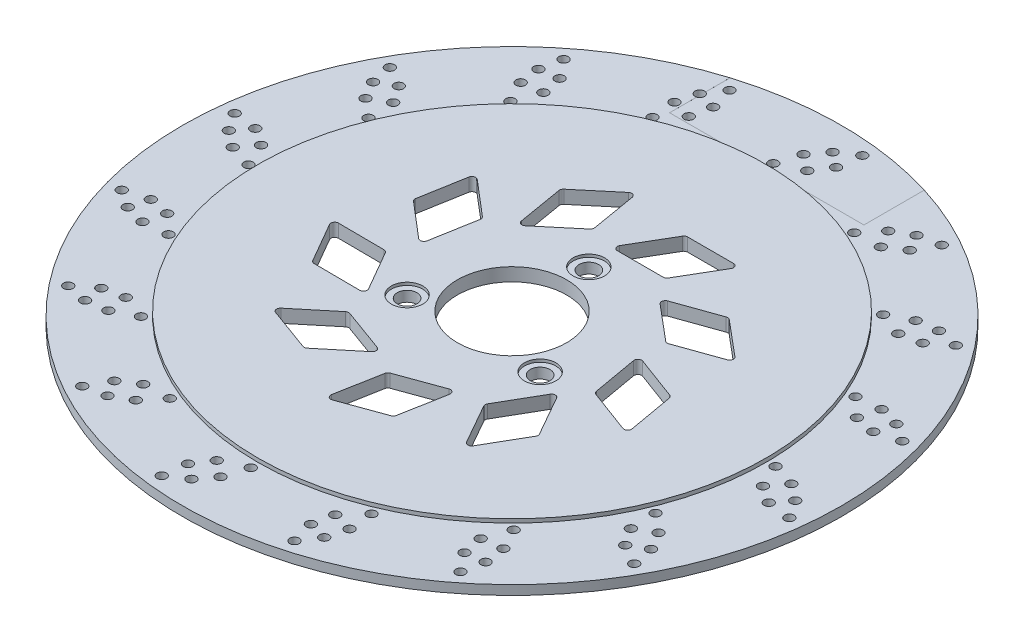
from build123d import *

# Parameters (mm, degrees)
SKETCH1_R           = 135
SKETCH1_R_2         = 29
BOSS_EXTRUDE1_DEPTH = 7
SKETCH1_3_R         = 175
SKETCH1_3_R_2       = 135
BOSS_EXTRUDE2_DEPTH = 5
SKETCH7_R           = 5.2
CUT_EXTRUDE9_DEPTH  = 248.586348574
SKETCH11_R          = 8.35
CUT_EXTRUDE10_DEPTH = 1.5
CIRPATTERN1_COUNT   = 3
CIRPATTERN2_COUNT   = 3
CUT_EXTRUDE11_DEPTH = 248.586348574
SKETCH14_R          = 2.5
CUT_EXTRUDE12_DEPTH = 248.53787589
CIRPATTERN3_COUNT   = 16
SKETCH15_R          = 175
SKETCH15_R_2        = 135
CUT_EXTRUDE13_DEPTH = 0.01
SKETCH16_W          = 103.216038505
SKETCH16_H          = 40.53333701
CUT_EXTRUDE14_DEPTH = 0.01
SKETCH17_W          = 102.14000893
SKETCH17_H          = 42.38101065
CUT_EXTRUDE15_DEPTH = 0.01


with BuildPart() as part:
    # Sketch1 → Boss-Extrude1 (new body)
    with BuildSketch(Plane(origin=(0, 0, 0), x_dir=(1, 0, 0), z_dir=(0, 1, 0))):
        with Locations(Location((0, 0, 0), (0, 0, 270))):
            Circle(SKETCH1_R)
        with Locations(Location((0, 0, 0), (0, 0, 270))):
            Circle(SKETCH1_R_2, mode=Mode.SUBTRACT)
    extrude(amount=BOSS_EXTRUDE1_DEPTH)

    # Sketch1<3> → Boss-Extrude2 (add)
    with BuildSketch(Plane(origin=(0, 0, 0), x_dir=(1, 0, 0), z_dir=(0, 1, 0))):
        with Locations(Location((0, 0, 0), (0, 0, 270))):
            Circle(SKETCH1_3_R)
        with Locations(Location((0, 0, 0), (0, 0, 270))):
            Circle(SKETCH1_3_R_2, mode=Mode.SUBTRACT)
    extrude(amount=BOSS_EXTRUDE2_DEPTH)

    # Sketch7 → Cut-Extrude9 (cut, through all)
    with BuildSketch(Plane(origin=(0, 7, 0), x_dir=(1, 0, 0), z_dir=(0, 1, 0))):
        with Locations(Location((0, 40.8, 0), (0, 0, 270))):
            Circle(SKETCH7_R)
    cut_extrude9 = extrude(amount=-CUT_EXTRUDE9_DEPTH, mode=Mode.SUBTRACT)

    # Sketch11 → Cut-Extrude10 (cut)
    with BuildSketch(Plane(origin=(0, 7, 0), x_dir=(1, 0, 0), z_dir=(0, 1, 0))):
        with Locations(Location((0, 40.8, 0), (0, 0, 270))):
            Circle(SKETCH11_R)
    cut_extrude10 = extrude(amount=-CUT_EXTRUDE10_DEPTH, mode=Mode.SUBTRACT)

    # CirPattern1: Cut-Extrude9 ×3 about axis
    cirpattern1_axis = Axis((0, 0, 0), (0, 1, 0))
    for i in range(1, CIRPATTERN1_COUNT):
        add(cut_extrude9.rotate(cirpattern1_axis, i * 360 / CIRPATTERN1_COUNT), mode=Mode.SUBTRACT)

    # CirPattern2: Cut-Extrude10 ×3 about axis
    cirpattern2_axis = Axis((0, 0, 0), (0, 1, 0))
    for i in range(1, CIRPATTERN2_COUNT):
        add(cut_extrude10.rotate(cirpattern2_axis, i * 360 / CIRPATTERN2_COUNT), mode=Mode.SUBTRACT)

    # Sketch13 → Cut-Extrude11 (cut, through all)
    with BuildSketch(Plane(origin=(0, 7, 0), x_dir=(1, 0, 0), z_dir=(0, 1, 0))):
        with BuildLine():
            Line((0.125749805, 55.8), (24.472230204, 55.8))
            ThreePointArc((24.472230204, 55.8), (25.466236439, 56.064502491), (26.197325549, 56.788048395))
            Line((26.197325549, 56.788048395), (38.516055508, 77.788048395))
            ThreePointArc((38.516055508, 77.788048395), (38.526457673, 79.794006235), (36.790960164, 80.8))
            Line((36.790960164, 80.8), (12.444479765, 80.8))
            ThreePointArc((12.444479765, 80.8), (11.45047353, 80.535497509), (10.71938442, 79.811951605))
            Line((10.71938442, 79.811951605), (-1.599345539, 58.811951605))
            ThreePointArc((-1.599345539, 58.811951605), (-1.609747704, 56.805993765), (0.125749805, 55.8))
        make_face()
        with BuildLine():
            Line((80.119731336, 38.247949908), (61.469245317, 53.897565848))
            ThreePointArc((61.469245317, 53.897565848), (60.537773441, 54.333880077), (59.512640348, 54.249546779))
            Line((59.512640348, 54.249546779), (36.577405913, 46.080940458))
            ThreePointArc((36.577405913, 46.080940458), (35.280032548, 44.550973984), (35.962860444, 42.664781755))
            Line((35.962860444, 42.664781755), (54.613346463, 27.015165815))
            ThreePointArc((54.613346463, 27.015165815), (55.544818339, 26.578851587), (56.569951431, 26.663184884))
            Line((56.569951431, 26.663184884), (79.505185866, 34.831791205))
            ThreePointArc((79.505185866, 34.831791205), (80.802559232, 36.361757679), (80.119731336, 38.247949908))
        make_face()
        with BuildLine():
            Line((85.959565155, -22.200008861), (81.731843201, 1.776593795))
            ThreePointArc((81.731843201, 1.776593795), (81.298751726, 2.709568466), (80.459245818, 3.303908262))
            Line((80.459245818, 3.303908262), (57.639157996, 11.788877302))
            ThreePointArc((57.639157996, 11.788877302), (55.661868846, 11.450790511), (54.972524367, 9.566970124))
            Line((54.972524367, 9.566970124), (59.200246321, -14.409632531))
            ThreePointArc((59.200246321, -14.409632531), (59.633337795, -15.342607202), (60.472843703, -15.936946998))
            Line((60.472843703, -15.936946998), (83.292931525, -24.421916038))
            ThreePointArc((83.292931525, -24.421916038), (85.270220675, -24.083829247), (85.959565155, -22.200008861))
        make_face()
        with BuildLine():
            Line((51.577938472, -72.259604595), (63.751178672, -51.174934076))
            ThreePointArc((63.751178672, -51.174934076), (64.019115913, -50.18184818), (63.758051334, -49.186933486))
            Line((63.758051334, -49.186933486), (51.730882834, -28.018600399))
            ThreePointArc((51.730882834, -28.018600399), (49.998873468, -27.006612941), (48.259908557, -28.006600989))
            Line((48.259908557, -28.006600989), (36.086668357, -49.091271507))
            ThreePointArc((36.086668357, -49.091271507), (35.818731116, -50.084357404), (36.079795695, -51.079272097))
            Line((36.079795695, -51.079272097), (48.106964195, -72.247605185))
            ThreePointArc((48.106964195, -72.247605185), (49.838973561, -73.259592643), (51.577938472, -72.259604595))
        make_face()
        with BuildLine():
            Line((-6.937603477, -88.507396099), (15.940604496, -80.180409384))
            ThreePointArc((15.940604496, -80.180409384), (16.78419964, -79.59188819), (17.223731408, -78.661930241))
            Line((17.223731408, -78.661930241), (21.617128039, -54.715131418))
            ThreePointArc((21.617128039, -54.715131418), (20.940824888, -52.826589888), (18.965920553, -52.474840078))
            Line((18.965920553, -52.474840078), (-3.91228742, -60.801826793))
            ThreePointArc((-3.91228742, -60.801826793), (-4.755882564, -61.390347987), (-5.195414332, -62.320305936))
            Line((-5.195414332, -62.320305936), (-9.588810962, -86.267104759))
            ThreePointArc((-9.588810962, -86.267104759), (-8.912507811, -88.155646288), (-6.937603477, -88.507396099))
        make_face()
        with BuildLine():
            Line((-62.206988287, -63.340861155), (-39.328780314, -71.667847871))
            ThreePointArc((-39.328780314, -71.667847871), (-38.30425481, -71.759266987), (-37.369788494, -71.329403442))
            Line((-37.369788494, -71.329403442), (-18.611545844, -55.809112192))
            ThreePointArc((-18.611545844, -55.809112192), (-17.915693019, -53.927686162), (-19.20245709, -52.388786137))
            Line((-19.20245709, -52.388786137), (-42.080665063, -44.061799422))
            ThreePointArc((-42.080665063, -44.061799422), (-43.105190567, -43.970380305), (-44.039656883, -44.40024385))
            Line((-44.039656883, -44.40024385), (-62.797899533, -59.9205351))
            ThreePointArc((-62.797899533, -59.9205351), (-63.493752358, -61.80196113), (-62.206988287, -63.340861155))
        make_face()
        with BuildLine():
            Line((-88.369056554, -8.535701158), (-76.195816355, -29.620371676))
            ThreePointArc((-76.195816355, -29.620371676), (-75.469747361, -30.348955082), (-74.477593672, -30.620323871))
            Line((-74.477593672, -30.620323871), (-50.131695213, -30.788656958))
            ThreePointArc((-50.131695213, -30.788656958), (-48.389283682, -29.794686577), (-48.38581628, -27.788704763))
            Line((-48.38581628, -27.788704763), (-60.55905648, -6.704034245))
            ThreePointArc((-60.55905648, -6.704034245), (-61.285125474, -5.975450839), (-62.277279162, -5.70408205))
            Line((-62.277279162, -5.70408205), (-86.623177622, -5.535748963))
            ThreePointArc((-86.623177622, -5.535748963), (-88.365589152, -6.529719344), (-88.369056554, -8.535701158))
        make_face()
        with BuildLine():
            Line((-73.182285778, 50.264140438), (-77.410007732, 26.287537783))
            ThreePointArc((-77.410007732, 26.287537783), (-77.322131, 25.262702361), (-76.736529675, 24.41707771))
            Line((-76.736529675, 24.41707771), (-58.19469187, 8.638885207))
            ThreePointArc((-58.19469187, 8.638885207), (-56.221015354, 8.280310152), (-54.928938915, 9.81475257))
            Line((-54.928938915, 9.81475257), (-50.701216961, 33.791355226))
            ThreePointArc((-50.701216961, 33.791355226), (-50.789093693, 34.816190648), (-51.374695018, 35.661815299))
            Line((-51.374695018, 35.661815299), (-69.916532823, 51.440007801))
            ThreePointArc((-69.916532823, 51.440007801), (-71.890209339, 51.798582857), (-73.182285778, 50.264140438))
        make_face()
        with BuildLine():
            Line((-23.752734786, 85.545564263), (-42.403220805, 69.895948324))
            ThreePointArc((-42.403220805, 69.895948324), (-42.994654834, 69.054392769), (-43.089615242, 68.030189428))
            Line((-43.089615242, 68.030189428), (-39.02777007, 44.024929137))
            ThreePointArc((-39.02777007, 44.024929137), (-37.746333745, 42.481589899), (-35.770225195, 42.826510261))
            Line((-35.770225195, 42.826510261), (-17.119739176, 58.4761262))
            ThreePointArc((-17.119739176, 58.4761262), (-16.528305147, 59.317681755), (-16.433344739, 60.341885096))
            Line((-16.433344739, 60.341885096), (-20.495189911, 84.347145387))
            ThreePointArc((-20.495189911, 84.347145387), (-21.776626235, 85.890484625), (-23.752734786, 85.545564263))
        make_face()
    extrude(amount=-CUT_EXTRUDE11_DEPTH, mode=Mode.SUBTRACT)

    # Sketch14 → Cut-Extrude12 (cut, through all)
    with BuildSketch(Plane(origin=(0, 5, 0), x_dir=(1, 0, 0), z_dir=(0, 1, 0))):
        with Locations(Location((19.371769386, 166.652812155, 0), (0, 0, 270))):
            Circle(SKETCH14_R)
        with Locations(Location((-0.614063154, 139.355520084, 0), (0, 0, 270))):
            Circle(SKETCH14_R)
        with Locations(Location((9.923971718, 160.30436076, 0), (0, 0, 270))):
            Circle(SKETCH14_R)
        with Locations(Location((3.241074211, 151.567148337, 0), (0, 0, 270))):
            Circle(SKETCH14_R)
        with Locations(Location((17.867298021, 154.229530124, 0), (0, 0, 270))):
            Circle(SKETCH14_R)
        with Locations(Location((11.764209377, 145.048000991, 0), (0, 0, 270))):
            Circle(SKETCH14_R)
    cut_extrude12 = extrude(amount=-CUT_EXTRUDE12_DEPTH, mode=Mode.SUBTRACT)

    # CirPattern3: Cut-Extrude12 ×16 about axis
    cirpattern3_axis = Axis((0, 0, 0), (0, 1, 0))
    for i in range(1, CIRPATTERN3_COUNT):
        add(cut_extrude12.rotate(cirpattern3_axis, i * 360 / CIRPATTERN3_COUNT), mode=Mode.SUBTRACT)

    # Sketch15 → Cut-Extrude13 (cut)
    with BuildSketch(Plane(origin=(0, 0, 0), x_dir=(1, 0, 0), z_dir=(0, 1, 0))):
        with Locations(Location((0, 0, 0), (0, 0, 270))):
            Circle(SKETCH15_R)
        with Locations(Location((0, 0, 0), (0, 0, 270))):
            Circle(SKETCH15_R_2, mode=Mode.SUBTRACT)
    extrude(amount=CUT_EXTRUDE13_DEPTH, mode=Mode.SUBTRACT)

    # Sketch16 → Cut-Extrude14 (cut)
    with BuildSketch(Plane(origin=(0, 5, 0), x_dir=(1, 0, 0), z_dir=(0, 1, 0))):
        with Locations((0.15788903, 155.384070993)):
            Rectangle(SKETCH16_W, SKETCH16_H)
    extrude(amount=-CUT_EXTRUDE14_DEPTH, mode=Mode.SUBTRACT)

    # Sketch17 → Cut-Extrude15 (cut)
    with BuildSketch(Plane(origin=(0, 0.01, 0), x_dir=(-1, 0, 0), z_dir=(0, -1, 0))):
        with Locations((-1.252363684, 156.456075718)):
            Rectangle(SKETCH17_W, SKETCH17_H)
    extrude(amount=-CUT_EXTRUDE15_DEPTH, mode=Mode.SUBTRACT)


solid = part.part
